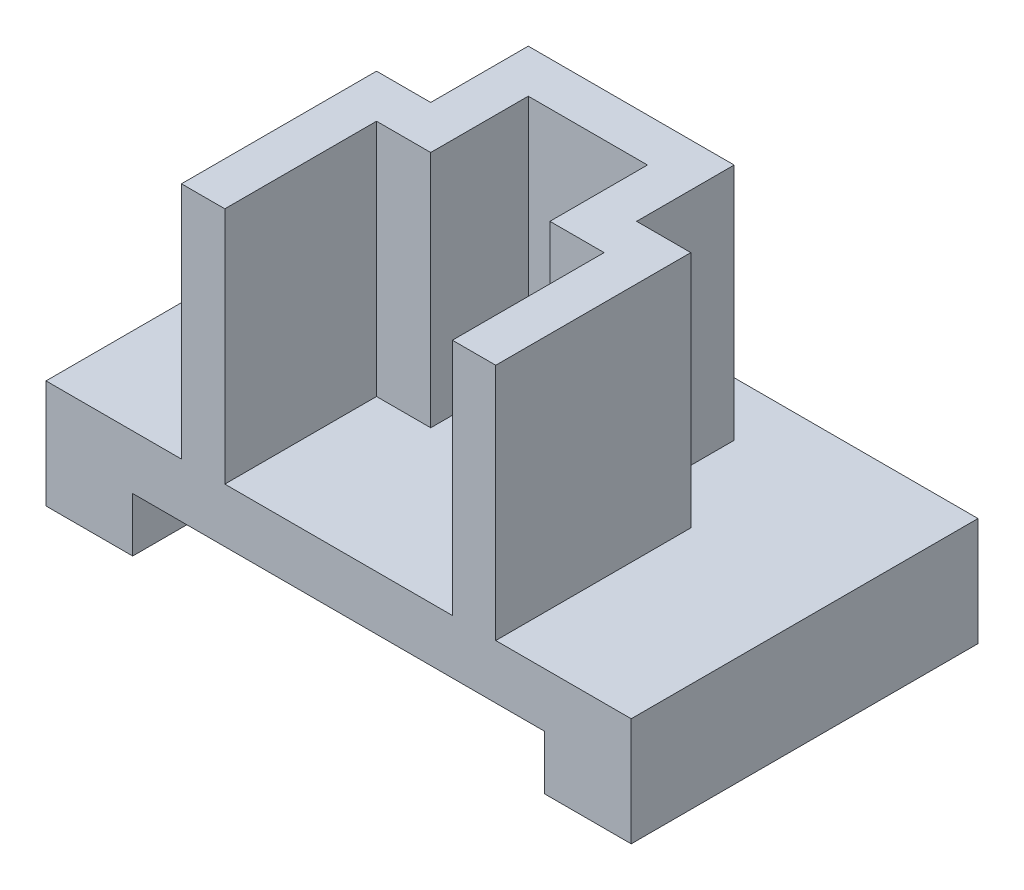
from build123d import *

# Parameters (mm, degrees)
EXTRUDE_1_DEPTH = 32
EXTRUDE_2_DEPTH = 22


with BuildPart() as part:
    # 草图1 → 凸台-拉伸1 (new body)
    with BuildSketch(Plane.XY):
        Polygon((-19, 0), (19, 0), (19, -5), (27, -5), (27, 5), (-27, 5), (-27, -5), (-19, -5), align=None)
    extrude(amount=EXTRUDE_1_DEPTH)

    # 草图2 → 凸台-拉伸2 (add)
    with BuildSketch(Plane(origin=(0, 5, 0), x_dir=(1, 0, 0), z_dir=(0, 1, 0))):
        Polygon((-14.5, -32), (-10.5, -32), (-10.5, -18), (-5.5, -18), (-5.5, -9), (5.5, -9), (5.5, -18), (10.5, -18), (10.5, -32), (14.5, -32), (14.5, -14), (9.5, -14), (9.5, -5), (-9.5, -5), (-9.5, -14), (-14.5, -14), align=None)
    extrude(amount=EXTRUDE_2_DEPTH)


solid = part.part
